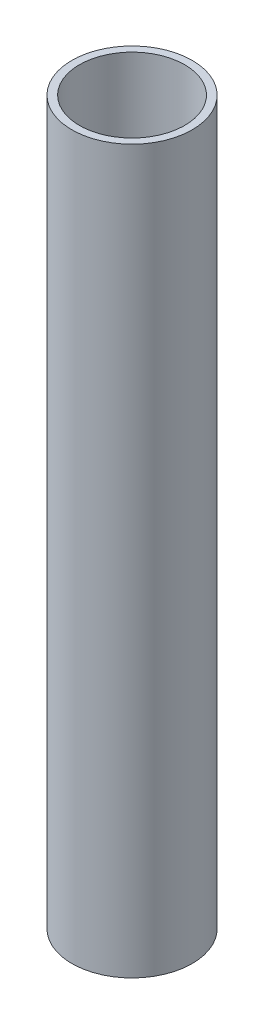
from build123d import *

# Parameters (mm, degrees)
SKETCH1_R           = 25.4
SKETCH1_R_2         = 22.225
BOSS_EXTRUDE1_DEPTH = 304.8


with BuildPart() as part:
    # Sketch1 → Boss-Extrude1 (new body)
    with BuildSketch(Plane(origin=(0, 0, 0), x_dir=(1, 0, 0), z_dir=(0, 1, 0))):
        with Locations(Location((0, 0, 0), (0, 0, 90))):
            Circle(SKETCH1_R)
        with Locations(Location((0, 0, 0), (0, 0, 90))):
            Circle(SKETCH1_R_2, mode=Mode.SUBTRACT)
    extrude(amount=BOSS_EXTRUDE1_DEPTH)


solid = part.part
